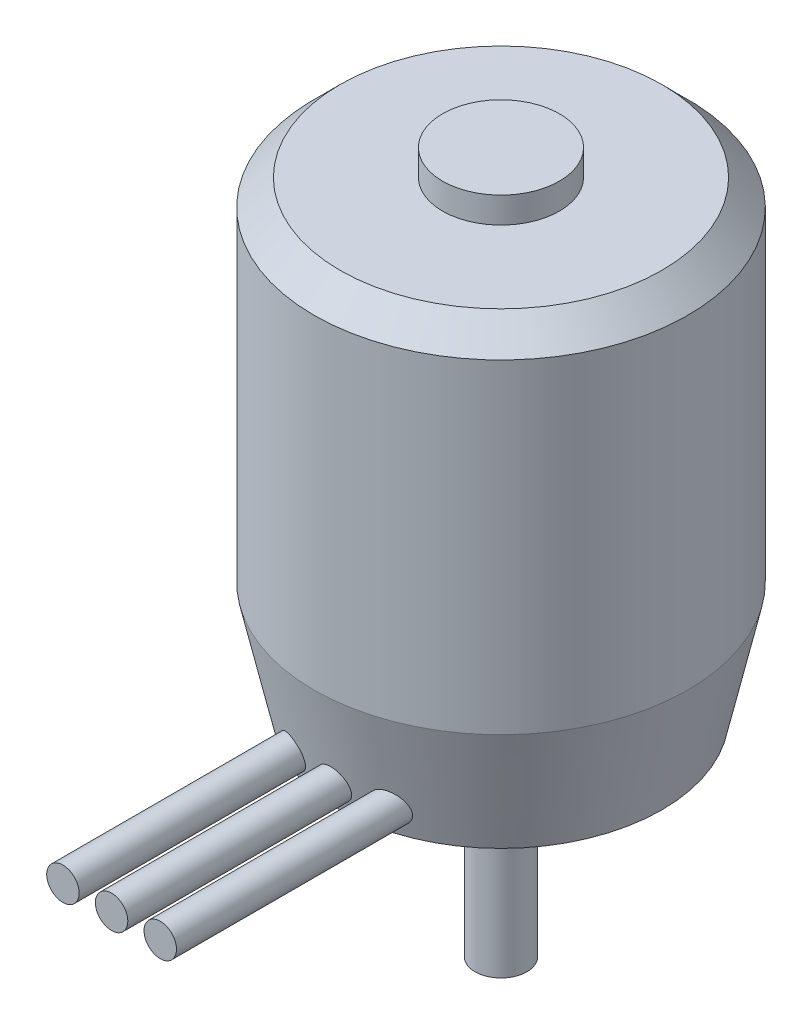
from build123d import *

# Parameters (mm, degrees)
SKETCH2_R           = 1.5
CUT_EXTRUDE1_DEPTH  = 6
SKETCH3_R           = 1.25
BOSS_EXTRUDE1_DEPTH = 20


with BuildPart() as part:
    # Sketch1 → Revolve2 (revolve)
    with BuildSketch(Plane.XY, mode=Mode.PRIVATE) as revolve2_sk:
        Polygon((14.4, -45.024704817), (14.4, -20.024704817), (12.4, -18.024704817), (4.5, -18.024704817), (4.5, -16.024704817), (0, -16.024704817), (0, -70.024704817), (2, -70.024704817), (2, -58.36883633), (3.9, -58.36883633), (3.9, -55.824704817), (2.9, -54.824704817), (2, -54.824704817), (2, -54.024704817), (12.4, -54.024704817), align=None)
    revolve(revolve2_sk.sketch.rotate(Axis((0, 0, 0), (0, -1, 0)), 90), axis=Axis((0, 0, 0), (0, -1, 0)))

    # Sketch2 → Cut-Extrude1 (cut)
    with BuildSketch(Plane.XZ.offset(54.024704817)):
        with Locations(Location((6.717514421, 6.717514421, 0), (0, 0, 270))):
            Circle(SKETCH2_R)
        with Locations(Location((5.656854249, -5.656854249, 0), (0, 0, 270))):
            Circle(SKETCH2_R)
        with Locations(Location((-6.717514421, -6.717514421, 0), (0, 0, 270))):
            Circle(SKETCH2_R)
        with Locations(Location((-5.656854249, 5.656854249, 0), (0, 0, 270))):
            Circle(SKETCH2_R)
    extrude(amount=-CUT_EXTRUDE1_DEPTH, mode=Mode.SUBTRACT)

    # Sketch3 → Boss-Extrude1 (add)
    with BuildSketch(Plane.XY.offset(10)):
        with Locations(Location((0, -52.024704817, 0), (0, 0, 224.284221248))):
            Circle(SKETCH3_R)
        with Locations(Location((3.75, -52.024704817, 0), (0, 0, 235.024751842))):
            Circle(SKETCH3_R)
        with Locations(Location((-3.75, -52.024704817, 0), (0, 0, 235.074308892))):
            Circle(SKETCH3_R)
    extrude(amount=BOSS_EXTRUDE1_DEPTH)


solid = part.part
